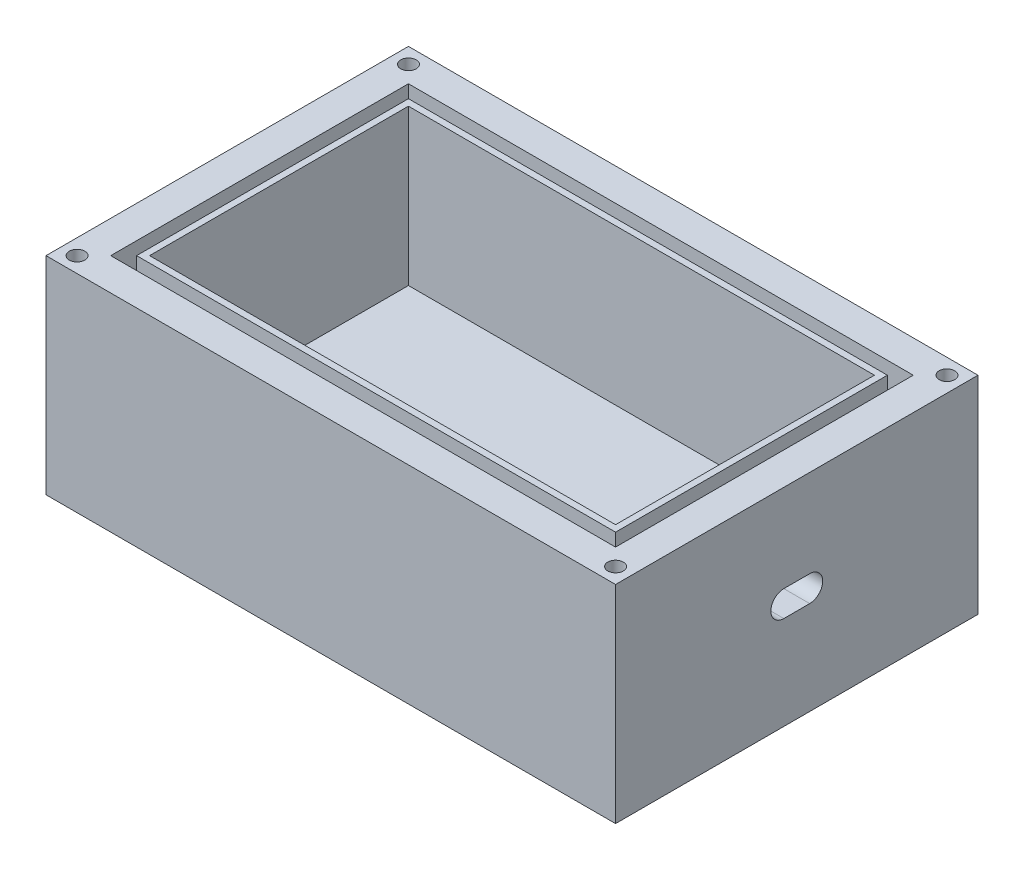
from build123d import *

# Parameters (mm, degrees)
SKETCH1_W               = 139.7
SKETCH1_H               = 88.9
BOSS_EXTRUDE1_DEPTH     = 50.8
SKETCH3_W               = 114.3
SKETCH3_H               = 63.5
CUT_EXTRUDE1_DEPTH      = 38.1
SKETCH6_W               = 123.825
SKETCH6_H               = 73.025
SKETCH6_W_2             = 117.475
SKETCH6_H_2             = 66.675
CUT_EXTRUDE2_DEPTH      = 6.35
SKETCH7_R               = 1.905
CUT_EXTRUDE3_DEPTH      = 12.7
MIRROR2_COPY_1_SKETCH_R = 1.905
MIRROR2_COPY_1_DEPTH    = 12.7
CUT_EXTRUDE5_DEPTH      = 12.7


with BuildPart() as part:
    # Sketch1 → Boss-Extrude1 (new body)
    with BuildSketch(Plane(origin=(0, 0, 0), x_dir=(1, 0, 0), z_dir=(0, 1, 0))):
        Rectangle(SKETCH1_W, SKETCH1_H)
    extrude(amount=BOSS_EXTRUDE1_DEPTH)

    # Sketch3 → Cut-Extrude1 (cut)
    with BuildSketch(Plane(origin=(0, 50.8, 0), x_dir=(1, 0, 0), z_dir=(0, 1, 0))):
        Rectangle(SKETCH3_W, SKETCH3_H)
    extrude(amount=-CUT_EXTRUDE1_DEPTH, mode=Mode.SUBTRACT)

    # Sketch6 → Cut-Extrude2 (cut)
    with BuildSketch(Plane(origin=(0, 50.8, 0), x_dir=(1, 0, 0), z_dir=(0, 1, 0))):
        Rectangle(SKETCH6_W, SKETCH6_H)
        Rectangle(SKETCH6_W_2, SKETCH6_H_2, mode=Mode.SUBTRACT)
    extrude(amount=-CUT_EXTRUDE2_DEPTH, mode=Mode.SUBTRACT)

    # Sketch7 → Cut-Extrude3 (cut)
    with BuildSketch(Plane(origin=(0, 50.8, 0), x_dir=(1, 0, 0), z_dir=(0, 1, 0))):
        with Locations(Location((-66.04, 40.64, 0), (0, 0, 270))):
            Circle(SKETCH7_R)
    cut_extrude3 = extrude(amount=-CUT_EXTRUDE3_DEPTH, mode=Mode.SUBTRACT)

    # Mirror1: Cut-Extrude3 across plane
    add(cut_extrude3.mirror(Plane(origin=(0, 0, 0), x_dir=(0, 0, 1), z_dir=(1, 0, 0))), mode=Mode.SUBTRACT)

    # Mirror2: Cut-Extrude3 across plane
    add(cut_extrude3.mirror(Plane.XY), mode=Mode.SUBTRACT)

    # Mirror2 copy 1 sketch → Mirror2 copy 1 (cut)
    with BuildSketch(Plane(origin=(0, 50.8, 0), x_dir=(-1, 0, 0), z_dir=(0, 1, 0))):
        with Locations(Location((-66.04, 40.64, 0), (0, 0, 270))):
            Circle(MIRROR2_COPY_1_SKETCH_R)
    extrude(amount=-MIRROR2_COPY_1_DEPTH, mode=Mode.SUBTRACT)

    # Sketch9 → Cut-Extrude5 (cut)
    with BuildSketch(Plane(origin=(69.85, 0, 0), x_dir=(0, 0, -1), z_dir=(1, 0, 0))):
        with BuildLine():
            Line((-3.175, 22.926701198), (3.175, 22.926701198))
            ThreePointArc((3.175, 22.926701198), (6.35, 26.101701198), (3.175, 29.276701198))
            Line((3.175, 29.276701198), (-3.175, 29.276701198))
            ThreePointArc((-3.175, 29.276701198), (-6.35, 26.101701198), (-3.175, 22.926701198))
        make_face()
    extrude(amount=-CUT_EXTRUDE5_DEPTH, mode=Mode.SUBTRACT)


solid = part.part
